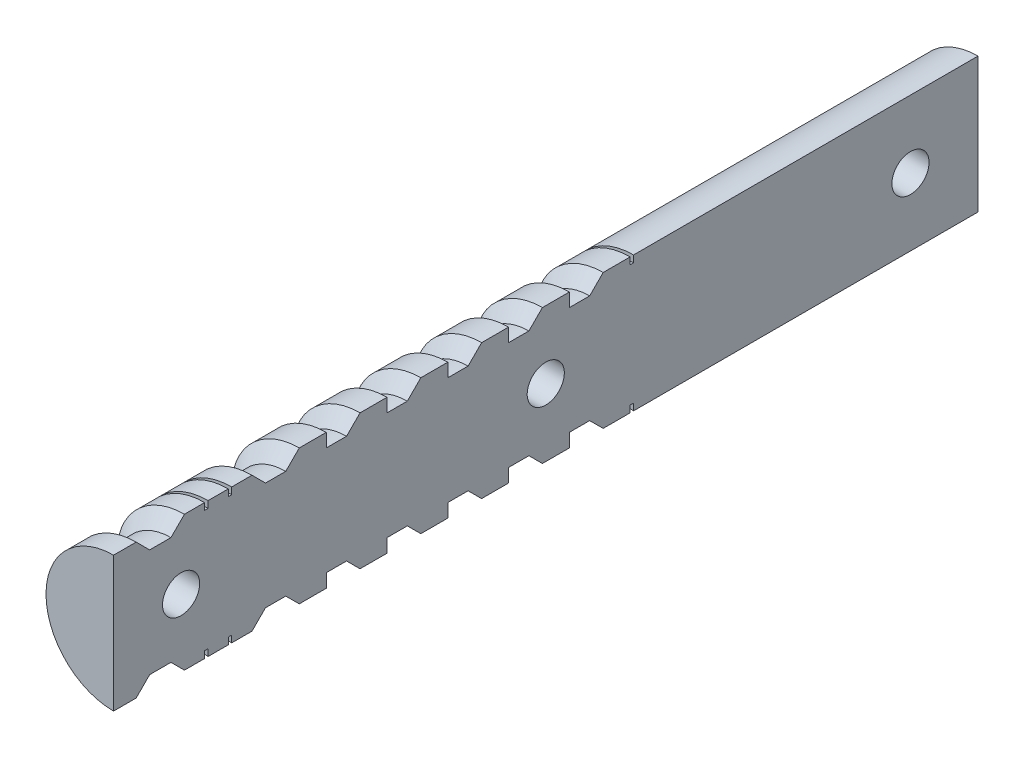
from build123d import *

# Parameters (mm, degrees)
SKETCH1_W               = 28.5
SKETCH1_H               = 23
CENTRE_BLOCK_DEPTH      = 128
TOP_CYLINDER_DEPTH      = 7
TOP_CYLINDER_DEPTH_BACK = 90
CUT_REVOLVE2_ANGLE      = 180
NOSE_DEPTH              = 131.828370394
T_CROSS_REACH           = 134.885
SKETCH6_R               = 12
BARREL_DEPTH            = 7
SIDE_CYLINDER_DEPTH     = 128
CUT_REVOLVE1_ANGLE      = 180
SKETCH8_R               = 2.75
BACK_HOLE_DEPTH         = 5
SKETCH12_W              = 5
SKETCH12_H              = 80
CUT_EXTRUDE4_DEPTH      = 5
SKETCH15_R              = 2.75
CUT_EXTRUDE6_DEPTH      = 10
FILLET2_R               = 1
SKETCH16_R              = 6.5
CUT_EXTRUDE7_DEPTH      = 20
SKETCH21_W              = 152.585030794
SKETCH21_H              = 42.838852891
CUT_EXTRUDE12_DEPTH     = 133.885289011
SKETCH24_R              = 2.75
CUT_EXTRUDE13_DEPTH     = 5


with BuildPart() as part:
    # Sketch1 → Centre block (new body)
    with BuildSketch(Plane.XY):
        Rectangle(SKETCH1_W, SKETCH1_H)
    extrude(amount=CENTRE_BLOCK_DEPTH)

    # Sketch3 → top cylinder (add, two sides: drawn at the far end of the back side and taken through both)
    with BuildSketch(Plane(origin=(0, 0, 0), x_dir=(-1, 0, 0), z_dir=(0, 0, -1)).offset(-TOP_CYLINDER_DEPTH_BACK)):
        with BuildLine():
            Line((-10, 11.5), (10, 11.5))
            ThreePointArc((10, 11.5), (0, 21.5), (-10, 11.5))
        make_face()
    extrude(amount=TOP_CYLINDER_DEPTH + TOP_CYLINDER_DEPTH_BACK)

    # Sketch9 → Cut-Revolve2 (revolve, cut)
    with BuildSketch(Plane(origin=(0, 11.5, 0), x_dir=(1, 0, 0), z_dir=(0, 1, 0))):
        Polygon((10, -78), (10, -81.888582416), (23.187071127, -81.888582416), (23.187071127, -74.052631606), (23.187071127, 0), (10, 0), (10, -8), (9.5, -8), (9.5, -8.5), (10, -8.5), (10, -11.5), (8, -13.5), (8, -16.5), (10, -18.5), (10, -21.5), (9.5, -21.5), (9.5, -22), (10, -22), (10, -25), (9.5, -25), (9.5, -25.5), (10, -25.5), (10, -28.5), (8, -30.5), (8, -33.5), (10, -35.5), (10, -38.5), (8, -38.5), (8, -41.5), (10, -43.5), (10, -48.5), (8, -48.5), (8, -51.5), (10, -53.5), (10, -58.5), (8, -58.5), (8, -60.3), (8, -61.5), (10, -63.5), (10, -68.5), (8, -68.5), (8, -70.3), (8, -71.5), (10, -73.5), (10, -74.052631606), (10, -77.5), (9.5, -77.5), (9.5, -78), align=None)
    revolve(axis=Axis((0, 11.5, -7), (0, 0, 1)), revolution_arc=CUT_REVOLVE2_ANGLE, mode=Mode.SUBTRACT)

    # Sketch4 → nose (cut, through all)
    with BuildSketch(Plane.XZ.offset(-11.5)):
        with BuildLine():
            Line((-3.25, -7), (-3.25, -2))
            ThreePointArc((-3.25, -2), (-3.835786438, -0.585786438), (-5.25, 0))
            Line((-5.25, 0), (-10, 0))
            Line((-10, 0), (-10, -7))
            Line((-10, -7), (-3.25, -7))
        make_face()
        with BuildLine():
            Line((3.75, -7), (3.75, -2))
            ThreePointArc((3.75, -2), (4.335786438, -0.585786438), (5.75, 0))
            Line((5.75, 0), (10, 0))
            Line((10, 0), (10, -7))
            Line((10, -7), (3.75, -7))
        make_face()
    extrude(amount=-NOSE_DEPTH, mode=Mode.SUBTRACT)

    # t cross: up to this face of the body (flat: up to its plane)
    t_cross_end = Plane(part.part.faces().sort_by_distance((-14.25, 0, 64))[0])
    # Sketch5 → t cross (add, up to the picked face)
    with BuildSketch(Plane(origin=(14.25, 0, 0), x_dir=(0, 0, -1), z_dir=(1, 0, 0)), mode=Mode.PRIVATE) as t_cross_sk1:
        with BuildLine():
            Line((-101, 11.5), (-81, 11.5))
            ThreePointArc((-81, 11.5), (-91, 21.5), (-101, 11.5))
        make_face()
    t_cross_tool1 = split(extrude(t_cross_sk1.sketch, amount=-T_CROSS_REACH, mode=Mode.PRIVATE), bisect_by=t_cross_end, keep=Keep.BOTH, mode=Mode.PRIVATE)
    add(t_cross_tool1.solids().sort_by(Axis((14.25, 15.744132, 91), (-1, 0, 0)))[0])

    # Sketch6 → Barrel (add)
    with BuildSketch(Plane(origin=(0, 0, 0), x_dir=(-1, 0, 0), z_dir=(0, 0, -1))):
        with Locations((0, 0.5)):
            Circle(SKETCH6_R)
    extrude(amount=BARREL_DEPTH)

    # Sketch2 → side cylinder (add)
    with BuildSketch(Plane(origin=(0, 0, 0), x_dir=(-1, 0, 0), z_dir=(0, 0, -1))):
        with BuildLine():
            Line((14.25, 10), (14.25, -10))
            ThreePointArc((14.25, -10), (24.25, 0), (14.25, 10))
        make_face()
    extrude(amount=-SIDE_CYLINDER_DEPTH)

    # Sketch7 → Cut-Revolve1 (revolve, cut)
    with BuildSketch(Plane(origin=(-14.25, 0, 0), x_dir=(0, 0, -1), z_dir=(1, 0, 0))):
        Polygon((-51, -10), (-51, -9), (-51.5, -9), (-51.5, -10), (-55.5, -10), (-57.5, -8), (-58.77482941, -8), (-60.5, -8), (-60.5, -10), (-64.5, -10), (-66.5, -8), (-67.77482941, -8), (-69.5, -8), (-69.5, -10), (-73.5, -10), (-75.5, -8), (-76.77482941, -8), (-78.5, -8), (-78.5, -10), (-82.5, -10), (-84.5, -8), (-85.77482941, -8), (-87.5, -8), (-87.5, -10), (-91.5, -10), (-93.5, -8), (-94.77482941, -8), (-96.5, -8), (-96.5, -10), (-100.5, -10), (-102.5, -8), (-105.5, -8), (-107.5, -10), (-110.5, -10), (-110.5, -9), (-111, -9), (-111, -10), (-114, -10), (-114, -9), (-114.5, -9), (-114.5, -10), (-117.5, -10), (-119.5, -8), (-122.65, -8), (-124.65, -10), (-124.65, -14.812383498), (-117.5, -14.812383498), (0, -14.812383498), (0, -10), align=None)
    revolve(axis=Axis((-14.25, 0, 135.382259058), (0, 0, -1)), revolution_arc=CUT_REVOLVE1_ANGLE, mode=Mode.SUBTRACT)

    # Sketch8 → Back hole (cut)
    with BuildSketch(Plane.XY.offset(128)):
        Circle(SKETCH8_R)
    extrude(amount=-BACK_HOLE_DEPTH, mode=Mode.SUBTRACT)

    # Sketch12 → Cut-Extrude4 (cut)
    with BuildSketch(Plane.XZ.offset(11.5)):
        with Locations((0, 78)):
            Rectangle(SKETCH12_W, SKETCH12_H)
    extrude(amount=-CUT_EXTRUDE4_DEPTH, mode=Mode.SUBTRACT)

    # Sketch15 → Cut-Extrude6 (cut)
    with BuildSketch(Plane(origin=(14.25, 0, 0), x_dir=(0, 0, -1), z_dir=(1, 0, 0))):
        with Locations((-91, 11.5)):
            Circle(SKETCH15_R)
        with Locations((-91, -5.5)):
            Circle(SKETCH15_R)
    extrude(amount=-CUT_EXTRUDE6_DEPTH, mode=Mode.SUBTRACT)

    # Fillet2
    fillet2_edges = [part.edges().sort_by_distance(p)[0] for p in [
        (-14.25, 11.5, 40.5),
        (14.25, 11.5, 40.5),
        (14.25, -11.5, 64),
        (-14.25, -11.5, 64),
        (-14.25, 11.5, 114.5),
        (14.25, 11.5, 114.5),
    ]]
    fillet(fillet2_edges, radius=FILLET2_R)

    # Sketch16 → Cut-Extrude7 (cut)
    with BuildSketch(Plane(origin=(0, 0, -7), x_dir=(-1, 0, 0), z_dir=(0, 0, -1))):
        Circle(SKETCH16_R)
    extrude(amount=-CUT_EXTRUDE7_DEPTH, mode=Mode.SUBTRACT)

    # Sketch21 → Cut-Extrude12 (cut, through all)
    with BuildSketch(Plane.ZY.offset(14.25)):
        with Locations((64.09795532, 3.365381731)):
            Rectangle(SKETCH21_W, SKETCH21_H)
    extrude(amount=-CUT_EXTRUDE12_DEPTH, mode=Mode.SUBTRACT)

    # Sketch24 → Cut-Extrude13 (cut)
    with BuildSketch(Plane(origin=(-14.25, 0, 0), x_dir=(0, 0, -1), z_dir=(1, 0, 0))):
        with Locations((-118, 0)):
            Circle(SKETCH24_R)
        with Locations((-64, 0)):
            Circle(SKETCH24_R)
        with Locations((-10, 0)):
            Circle(SKETCH24_R)
    extrude(amount=-CUT_EXTRUDE13_DEPTH, mode=Mode.SUBTRACT)


solid = part.part
